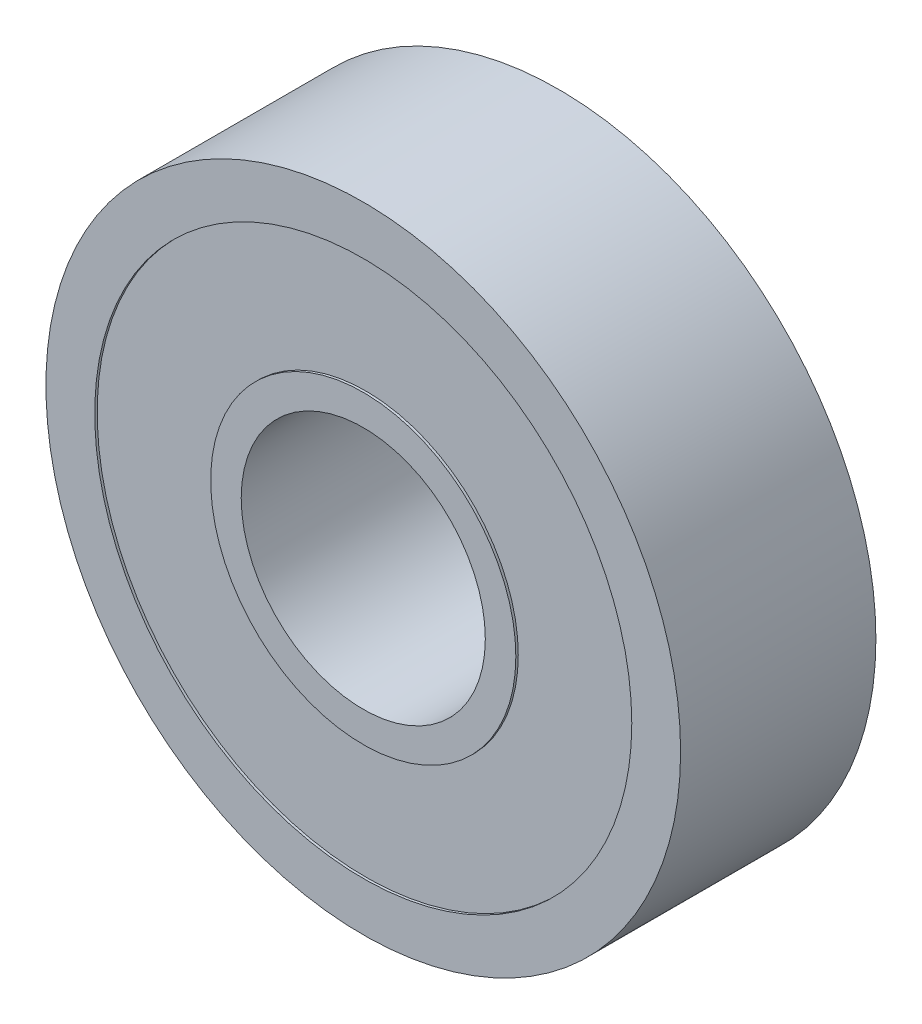
from build123d import *

# Parameters (mm, degrees)
CROQUIS1_R              = 13
CROQUIS1_R_2            = 5
SALIENTE_EXTRUIR1_DEPTH = 8
CROQUIS2_R              = 11
CROQUIS2_R_2            = 6.25
CORTAR_EXTRUIR1_DEPTH   = 0.1
CORTAR_EXTRUIR2_START   = -0.1
CROQUIS3_R              = 11
CROQUIS3_R_2            = 6.25
CORTAR_EXTRUIR2_DEPTH   = 0.1


with BuildPart() as part:
    # Croquis1 → Saliente-Extruir1 (new body)
    with BuildSketch(Plane.XY):
        Circle(CROQUIS1_R)
        Circle(CROQUIS1_R_2, mode=Mode.SUBTRACT)
    extrude(amount=SALIENTE_EXTRUIR1_DEPTH)

    # Croquis2 → Cortar-Extruir1 (cut)
    with BuildSketch(Plane.XY.offset(8)):
        Circle(CROQUIS2_R)
        Circle(CROQUIS2_R_2, mode=Mode.SUBTRACT)
    extrude(amount=-CORTAR_EXTRUIR1_DEPTH, mode=Mode.SUBTRACT)

    # Croquis3 → Cortar-Extruir2 (cut)
    with BuildSketch(Plane(origin=(0, 0, 0), x_dir=(-1, 0, 0), z_dir=(0, 0, -1)).offset(CORTAR_EXTRUIR2_START)):
        with Locations(Location((0, 0, 0), (0, 0, 180))):
            Circle(CROQUIS3_R)
        with Locations(Location((0, 0, 0), (0, 0, 180))):
            Circle(CROQUIS3_R_2, mode=Mode.SUBTRACT)
    extrude(amount=CORTAR_EXTRUIR2_DEPTH, mode=Mode.SUBTRACT)


solid = part.part
